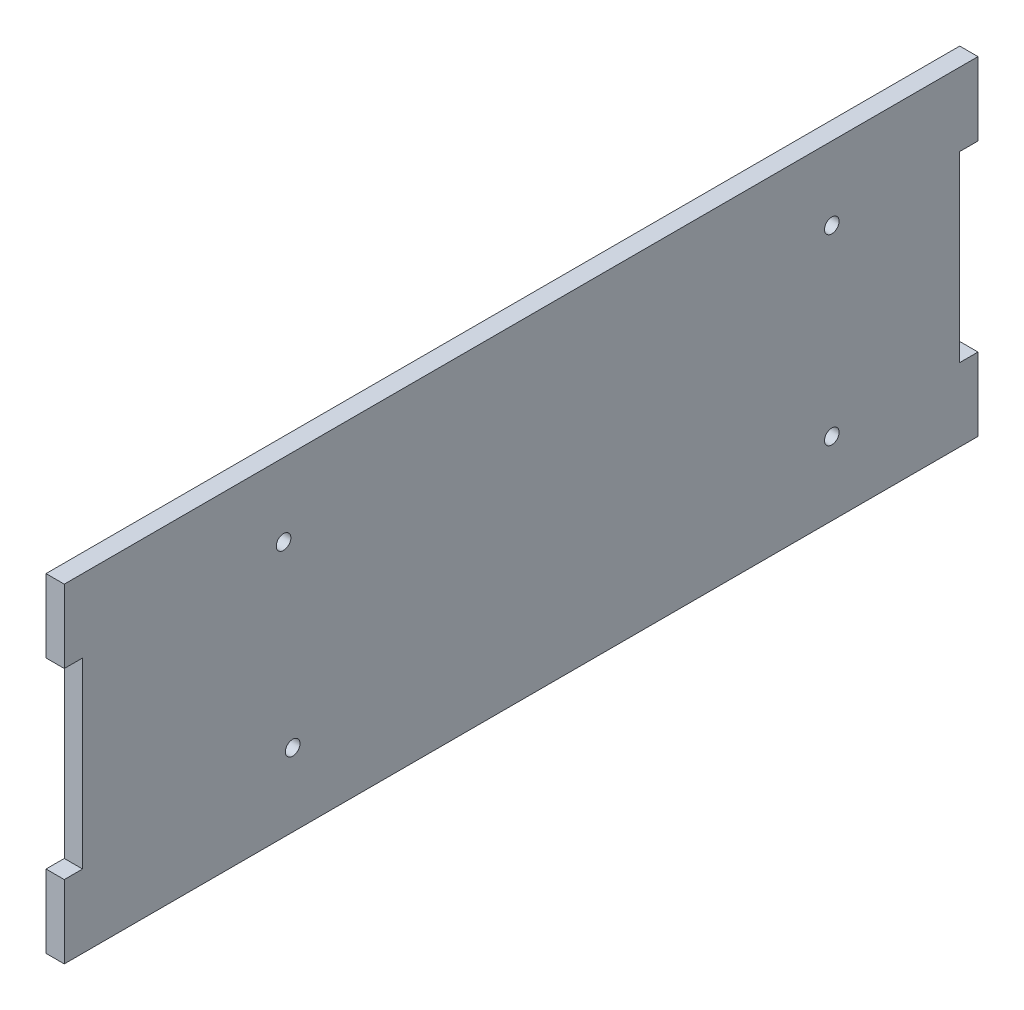
from build123d import *

# Parameters (mm, degrees)
SKETCH_1_R      = 2
EXTRUDE_1_DEPTH = 5


with BuildPart() as part:
    # 草图1 → 凸台-拉伸1 (new body)
    with BuildSketch(Plane(origin=(0, 0, 0), x_dir=(0, 0, -1), z_dir=(1, 0, 0))):
        Polygon((0, 0), (-250, 0), (-250, 20), (-245, 20), (-245, 70), (-250, 70), (-250, 90), (0, 90), (0, 70), (-5, 70), (-5, 20), (0, 20), align=None)
        with Locations((-40, 70)):
            Circle(SKETCH_1_R, mode=Mode.SUBTRACT)
        with Locations((-40, 20)):
            Circle(SKETCH_1_R, mode=Mode.SUBTRACT)
        with Locations((-187.5, 20)):
            Circle(SKETCH_1_R, mode=Mode.SUBTRACT)
        with Locations((-190, 70)):
            Circle(SKETCH_1_R, mode=Mode.SUBTRACT)
    extrude(amount=EXTRUDE_1_DEPTH)


solid = part.part
